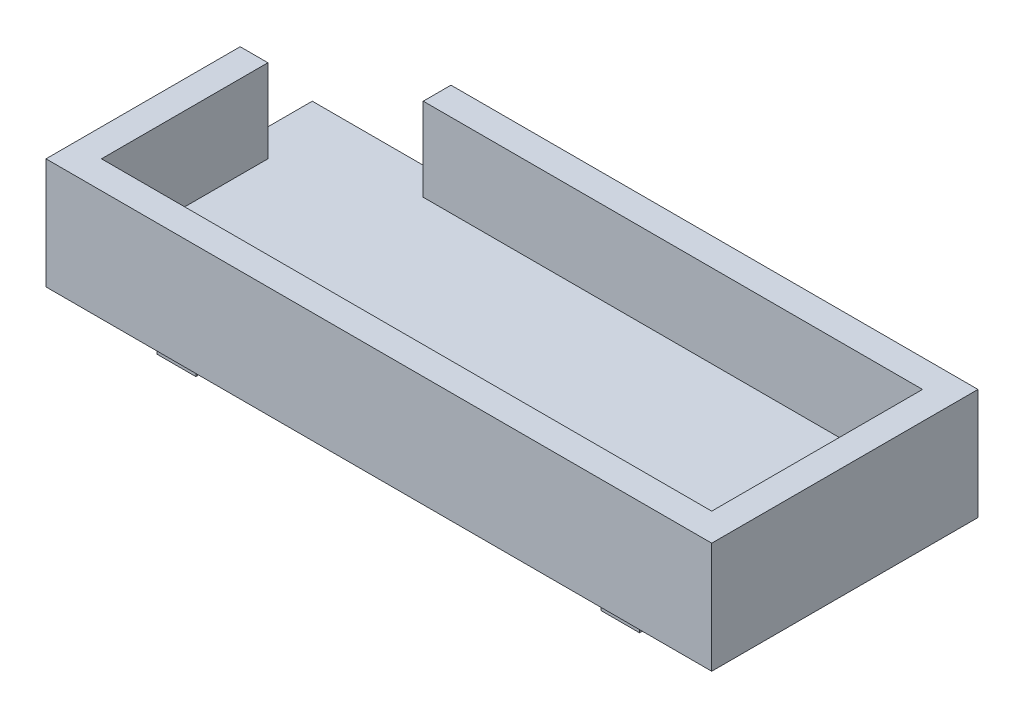
from build123d import *

# Parameters (mm, degrees)
SKETCH1_W           = 120
SKETCH1_H           = 48
BOSS_EXTRUDE1_DEPTH = 5
BOSS_EXTRUDE2_DEPTH = 15
SKETCH3_W           = 7
SKETCH3_H           = 3.5
BOSS_EXTRUDE3_DEPTH = 4


with BuildPart() as part:
    # Sketch1 → Boss-Extrude1 (new body)
    with BuildSketch(Plane(origin=(0, 0, 0), x_dir=(1, 0, 0), z_dir=(0, 1, 0))):
        with Locations((60, 24)):
            Rectangle(SKETCH1_W, SKETCH1_H)
    extrude(amount=BOSS_EXTRUDE1_DEPTH)

    # Sketch2 → Boss-Extrude2 (add)
    with BuildSketch(Plane(origin=(0, 5, 0), x_dir=(1, 0, 0), z_dir=(0, 1, 0))):
        Polygon((120, 48), (25, 48), (25, 43), (115, 43), (115, 5), (5, 5), (5, 35), (0, 35), (0, 0), (120, 0), align=None)
    extrude(amount=BOSS_EXTRUDE2_DEPTH)

    # Sketch3 → Boss-Extrude3 (add)
    with BuildSketch(Plane(origin=(0, 0, 0), x_dir=(-1, 0, 0), z_dir=(0, -1, 0))):
        with Locations((-100, 21.25)):
            Rectangle(SKETCH3_W, SKETCH3_H)
        with Locations((-100, 13.25)):
            Rectangle(SKETCH3_W, SKETCH3_H)
        with Locations((-100, 5.25)):
            Rectangle(SKETCH3_W, SKETCH3_H)
        with Locations((-20, 21.25)):
            Rectangle(SKETCH3_W, SKETCH3_H)
        with Locations((-20, 13.25)):
            Rectangle(SKETCH3_W, SKETCH3_H)
        with Locations((-20, 5.25)):
            Rectangle(SKETCH3_W, SKETCH3_H)
    extrude(amount=BOSS_EXTRUDE3_DEPTH)


solid = part.part
